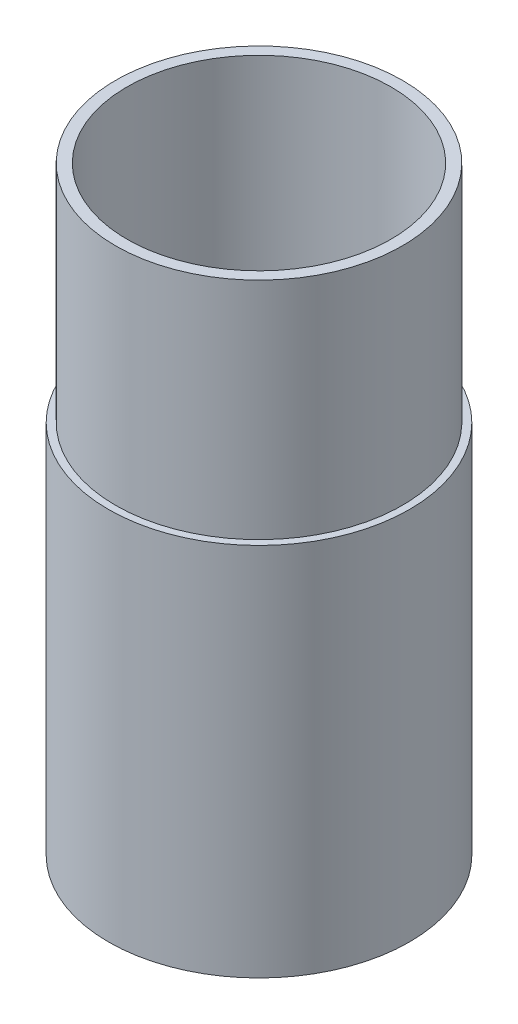
from build123d import *

# Parameters (mm, degrees)
SKETCH1_W   = 1.203987507
SKETCH1_H   = 63.5
SKETCH1_W_2 = 1.9304
SKETCH1_H_2 = 101.6


with BuildPart() as part:
    # Sketch1 → Revolve1 (revolve)
    with BuildSketch(Plane.XY, mode=Mode.PRIVATE) as revolve1_sk:
        with Locations((24.912306247, -11.823736117)):
            Rectangle(SKETCH1_W, SKETCH1_H)
        with Locations((23.345112493, 7.226263883)):
            Rectangle(SKETCH1_W_2, SKETCH1_H_2)
    revolve(revolve1_sk.sketch.rotate(Axis((0, 0, 0), (0, 1, 0)), 90), axis=Axis((0, 0, 0), (0, 1, 0)))


solid = part.part
